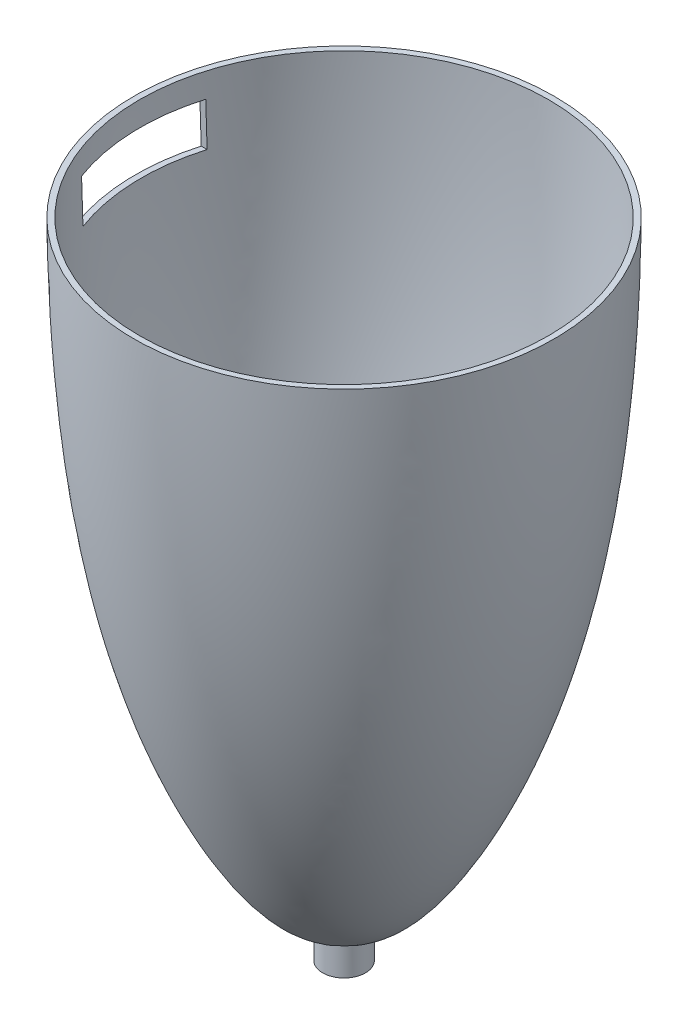
from build123d import *

# Parameters (mm, degrees)
SKETCH1_R           = 4.998477961
BOSS_EXTRUDE1_DEPTH = 10
SKETCH3_R           = 3.997542974
CUT_EXTRUDE2_DEPTH  = 10
SKETCH5_W           = 30
SKETCH5_H           = 10
CUT_EXTRUDE3_DEPTH  = 100


with BuildPart() as part:
    # Sketch1 → Boss-Extrude1 (new body)
    with BuildSketch(Plane(origin=(0, 0, 0), x_dir=(1, 0, 0), z_dir=(0, 1, 0))):
        with Locations(Location((0, 0, 0), (0, 0, 270))):
            Circle(SKETCH1_R)
    extrude(amount=BOSS_EXTRUDE1_DEPTH)

    # Sketch3 → Cut-Extrude2 (cut)
    with BuildSketch(Plane(origin=(0, 10, 0), x_dir=(1, 0, 0), z_dir=(0, 1, 0))):
        with Locations(Location((0, 0, 0), (0, 0, 270))):
            Circle(SKETCH3_R)
    extrude(amount=-CUT_EXTRUDE2_DEPTH, mode=Mode.SUBTRACT)

    # Sketch4 → Revolve4 (revolve)
    with BuildSketch(Plane(origin=(0, 0, 0), x_dir=(0, 0, -1), z_dir=(1, 0, 0))):
        with BuildLine():
            Line((1.688432562, 10), (0.892408722, 10))
            add(Edge.make_bspline(
                [(0.892408722, 10), (9.409222495, 3.349671641), (37.714348692, 41.382673141), (48.515883525, 102.671314041), (49, 150)],
                knots=[0, 0, 0, 0, 0.419006106, 1, 1, 1, 1], degree=3))
            Line((49, 150), (47.674671081, 149.972202923))
            add(Edge.make_bspline(
                [(1.688432562, 10), (10.004510378, 5.872710682), (36.756908089, 43.536797773), (47.190554606, 102.643516964), (47.674671081, 149.972202923)],
                knots=[0, 0, 0, 0, 0.398399462, 1, 1, 1, 1], degree=3))
        make_face()
    revolve(axis=Axis((0, 10, 0), (0, 1, 0)))

    # Sketch5 → Cut-Extrude3 (cut)
    with BuildSketch(Plane(origin=(0, 0, 0), x_dir=(0, 0, -1), z_dir=(1, 0, 0))):
        with Locations((-1.584887535, 139.349310202)):
            Rectangle(SKETCH5_W, SKETCH5_H)
    extrude(amount=-CUT_EXTRUDE3_DEPTH, mode=Mode.SUBTRACT)


solid = part.part
